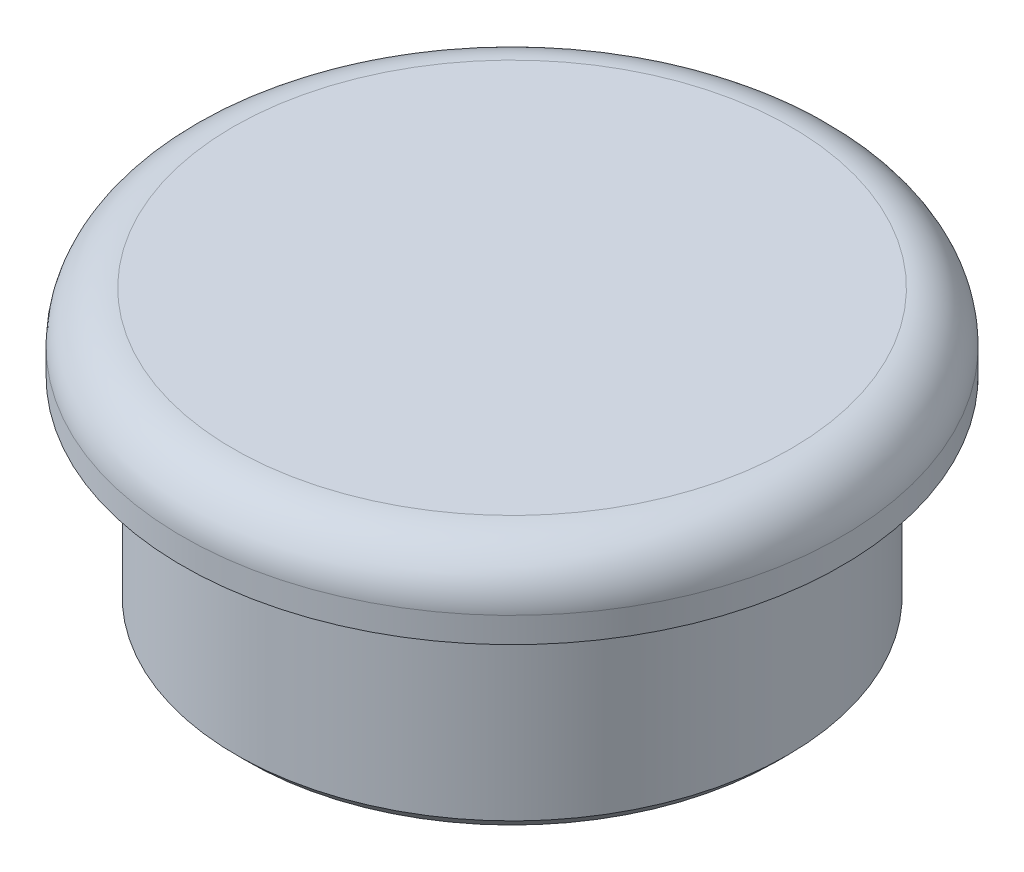
from build123d import *

# Parameters (mm, degrees)
FILLET1_R     = 3.175
CHAMFER1_SIZE = 0.762
FILLET2_R     = 2.54


with BuildPart() as part:
    # Sketch3 → Revolve1 (revolve)
    with BuildSketch(Plane.XY):
        Polygon((-34.629025424, 22.543396893), (-13.991525424, 22.543396893), (-13.991525424, 17.780896893), (-28.977525424, 17.780896893), (-28.977525424, 5.080896893), (-31.263525424, 5.080896893), (-31.263525424, 17.780896893), (-34.629025424, 17.780896893), align=None)
    revolve(axis=Axis((-13.991525424, 22.543396893, 0), (0, -1, 0)))

    # Fillet1
    fillet1_edges = [part.edges().sort_by_distance(p)[0] for p in [
        (6.645974576, 22.543396893, 0),
    ]]
    fillet(fillet1_edges, radius=FILLET1_R)

    # Chamfer1
    chamfer1_edges = [part.edges().sort_by_distance(p)[0] for p in [
        (3.280474576, 17.780896893, 0),
        (3.280474576, 5.080896893, 0),
    ]]
    chamfer(chamfer1_edges, length=CHAMFER1_SIZE)

    # Fillet2
    fillet2_edges = [part.edges().sort_by_distance(p)[0] for p in [
        (0.994474576, 17.780896893, 0),
    ]]
    fillet(fillet2_edges, radius=FILLET2_R)


solid = part.part
